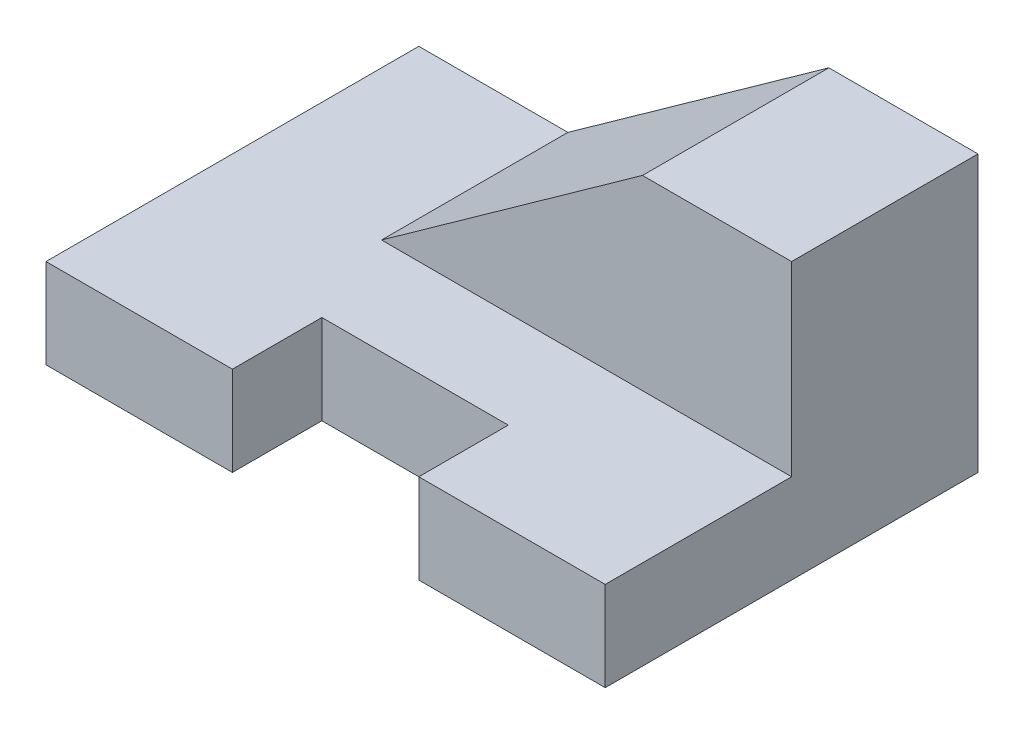
from build123d import *

# Parameters (mm, degrees)
BOSS_EXTRUDE1_DEPTH = 25
SKETCH1_3_W         = 25
SKETCH1_3_H         = 12
BOSS_EXTRUDE2_DEPTH = 50
SKETCH1_4_W         = 25
SKETCH1_4_H         = 12
BOSS_EXTRUDE3_DEPTH = 38


with BuildPart() as part:
    # Sketch1 → Boss-Extrude1 (new body)
    with BuildSketch(Plane.XY):
        Polygon((-25, 12), (0, 12), (0, 37), (-20, 37), (-55, 12), (-50, 12), align=None)
    extrude(amount=BOSS_EXTRUDE1_DEPTH)

    # Sketch1<3> → Boss-Extrude2 (add)
    with BuildSketch(Plane.XY):
        with Locations((-12.5, 6)):
            Rectangle(SKETCH1_3_W, SKETCH1_3_H)
        with Locations((-62.5, 6)):
            Rectangle(SKETCH1_3_W, SKETCH1_3_H)
    extrude(amount=BOSS_EXTRUDE2_DEPTH)

    # Sketch1<4> → Boss-Extrude3 (add)
    with BuildSketch(Plane.XY):
        with Locations((-37.5, 6)):
            Rectangle(SKETCH1_4_W, SKETCH1_4_H)
    extrude(amount=BOSS_EXTRUDE3_DEPTH)


solid = part.part
